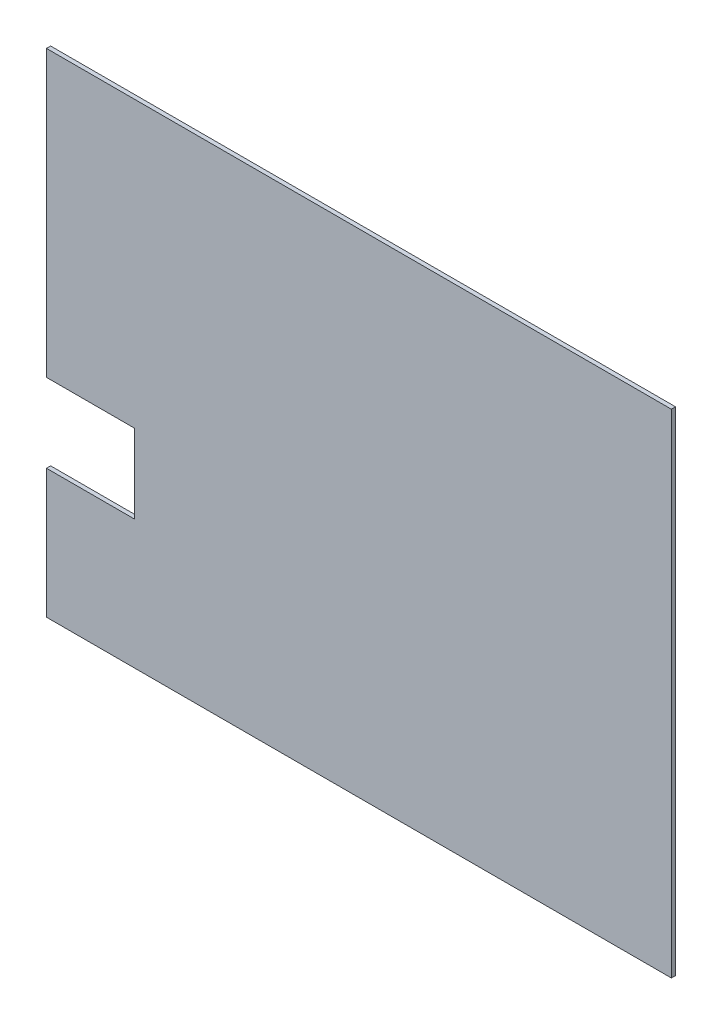
from build123d import *

# Parameters (mm, degrees)
SKETCH1_W               = 225.049134978
SKETCH1_H               = 177.4
BOSS_EXTRUDE1_DEPTH     = 1.5
CUT_EXTRUDE1_DEPTH      = 415.071536001
CUT_EXTRUDE1_DEPTH_BACK = 415.071536001
SKETCH2_W               = 37.712350792
SKETCH2_H               = 28.336351977


with BuildPart() as part:
    # Sketch1 → Boss-Extrude1 (new body)
    with BuildSketch(Plane.XY):
        with Locations((-223.710369918, -152.958961749)):
            Rectangle(SKETCH1_W, SKETCH1_H)
    extrude(amount=BOSS_EXTRUDE1_DEPTH)

    # Sketch2 → Cut-Extrude1 (cut, two sides: drawn at the far end of the back side and taken through both)
    with BuildSketch(Plane(origin=(0, 0, 0), x_dir=(-1, 0, 0), z_dir=(0, 0, -1)).offset(-CUT_EXTRUDE1_DEPTH_BACK)):
        with Locations((323.377350572, -181.028114896)):
            Rectangle(SKETCH2_W, SKETCH2_H)
    extrude(amount=CUT_EXTRUDE1_DEPTH + CUT_EXTRUDE1_DEPTH_BACK, mode=Mode.SUBTRACT)


solid = part.part
